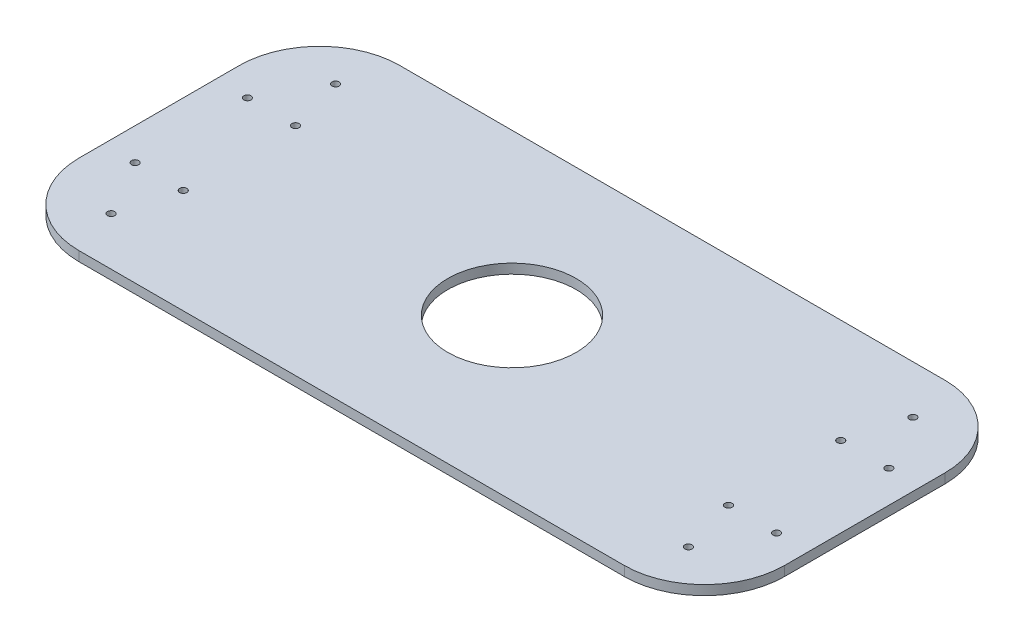
from build123d import *

# Parameters (mm, degrees)
SKETCH_6_W          = 440
SKETCH_6_H          = 200
SKETCH_6_R          = 40
EXTRUDE_2_DEPTH     = 6
SKETCH_7_R          = 2.25
CUT_EXTRUDE_1_DEPTH = 10


with BuildPart() as part:
    # 草图6 → 凸台-拉伸2 (new body)
    with BuildSketch(Plane(origin=(0, 0, 0), x_dir=(1, 0, 0), z_dir=(0, 1, 0))):
        Rectangle(SKETCH_6_W, SKETCH_6_H)
        with Locations(Location((0, 0, 0), (0, 0, 270))):
            Circle(SKETCH_6_R, mode=Mode.SUBTRACT)
    extrude(amount=EXTRUDE_2_DEPTH)

    # 草图7 → 切除-拉伸1 (cut)
    with BuildSketch(Plane(origin=(0, 6, 0), x_dir=(1, 0, 0), z_dir=(0, 1, 0))):
        with BuildLine():
            Line((-220, 100), (-220, 50))
            ThreePointArc((-220, 50), (-205.355339059, 85.355339059), (-170, 100))
            Line((-170, 100), (-220, 100))
        make_face()
        with BuildLine():
            ThreePointArc((-170, -100), (-205.355339059, -85.355339059), (-220, -50))
            Line((-220, -50), (-220, -100))
            Line((-220, -100), (-170, -100))
        make_face()
        with BuildLine():
            Line((220, 100), (170, 100))
            ThreePointArc((170, 100), (205.355339059, 85.355339059), (220, 50))
            Line((220, 50), (220, 100))
        make_face()
        with BuildLine():
            ThreePointArc((220, -50), (205.355339059, -85.355339059), (170, -100))
            Line((170, -100), (220, -100))
            Line((220, -100), (220, -50))
        make_face()
        with Locations(Location((170, 35, 0), (0, 0, 270))):
            Circle(SKETCH_7_R)
        with Locations(Location((200, 35, 0), (0, 0, 270))):
            Circle(SKETCH_7_R)
        with Locations(Location((180, 70, 0), (0, 0, 270))):
            Circle(SKETCH_7_R)
        with Locations(Location((-180, 70, 0), (0, 0, 270))):
            Circle(SKETCH_7_R)
        with Locations(Location((-200, 35, 0), (0, 0, 270))):
            Circle(SKETCH_7_R)
        with Locations(Location((-170, 35, 0), (0, 0, 270))):
            Circle(SKETCH_7_R)
        with Locations(Location((-170, -35, 0), (0, 0, 270))):
            Circle(SKETCH_7_R)
        with Locations(Location((-200, -35, 0), (0, 0, 270))):
            Circle(SKETCH_7_R)
        with Locations(Location((-180, -70, 0), (0, 0, 270))):
            Circle(SKETCH_7_R)
        with Locations(Location((180, -70, 0), (0, 0, 270))):
            Circle(SKETCH_7_R)
        with Locations(Location((200, -35, 0), (0, 0, 270))):
            Circle(SKETCH_7_R)
        with Locations(Location((170, -35, 0), (0, 0, 270))):
            Circle(SKETCH_7_R)
    extrude(amount=-CUT_EXTRUDE_1_DEPTH, mode=Mode.SUBTRACT)


solid = part.part
